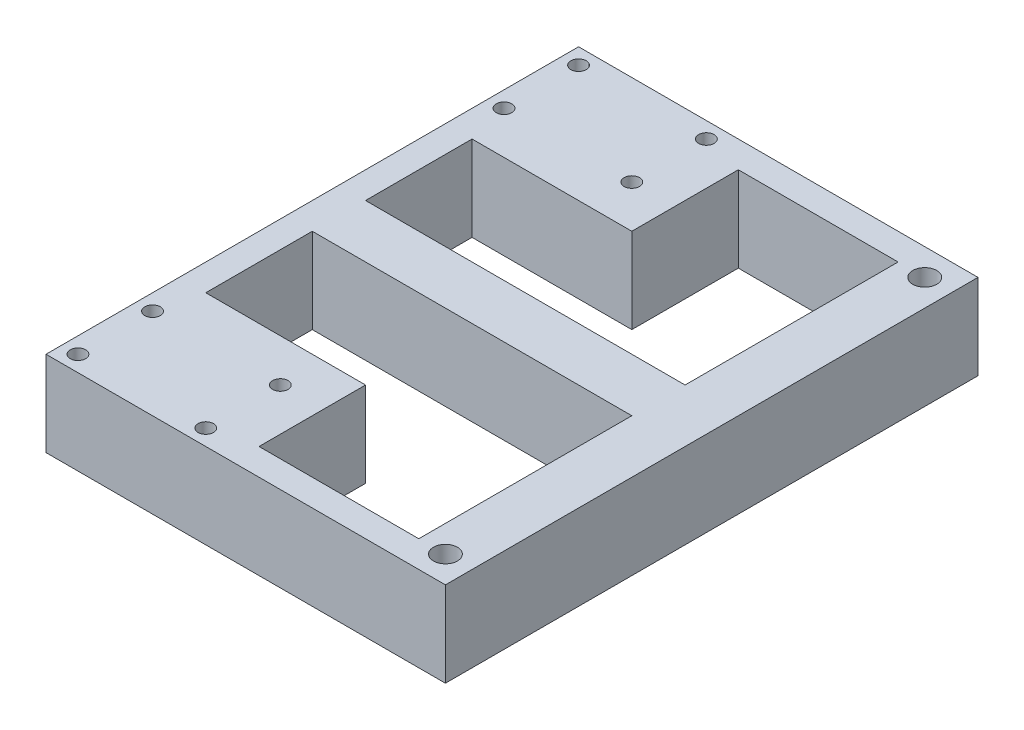
from build123d import *

# Parameters (mm, degrees)
SKETCH_1_W          = 75
SKETCH_1_H          = 100
EXTRUDE_1_DEPTH     = 16
CUT_EXTRUDE_5_REACH = 128.02
SKETCH_8_R          = 1.45
CUT_EXTRUDE_7_DEPTH = 127.019839708
SKETCH_9_W          = 40
SKETCH_9_H          = 16
EXTRUDE_2_DEPTH     = 5
SKETCH_10_R         = 2.25
CUT_EXTRUDE_8_DEPTH = 5
CUT_EXTRUDE_START   = -5
SKETCH_11_R         = 2.25
CUT_EXTRUDE_9_DEPTH = 5


with BuildPart() as part:
    # 草图1 → 凸台-拉伸1 (new body)
    with BuildSketch(Plane(origin=(0, 0, 0), x_dir=(1, 0, 0), z_dir=(0, 1, 0))):
        with Locations((-37.5, 50)):
            Rectangle(SKETCH_1_W, SKETCH_1_H)
    extrude(amount=EXTRUDE_1_DEPTH)

    # 草图6 → 切除-拉伸5 (cut, up to next)
    with BuildSketch(Plane(origin=(0, 16, 0), x_dir=(1, 0, 0), z_dir=(0, 1, 0)), mode=Mode.PRIVATE) as cut_extrude_5_sk1:
        Polygon((-40, 45), (-5, 45), (-5, 5), (-40, 5), (-40, 25), (-70, 25), (-70, 45), align=None)
    cut_extrude_5_tool1 = extrude(cut_extrude_5_sk1.sketch, amount=-CUT_EXTRUDE_5_REACH, mode=Mode.PRIVATE) & part.part
    # 草图6 → 切除-拉伸5 (cut, up to next)
    with BuildSketch(Plane(origin=(0, 16, 0), x_dir=(1, 0, 0), z_dir=(0, 1, 0)), mode=Mode.PRIVATE) as cut_extrude_5_sk2:
        Polygon((-40, 95), (-5, 95), (-5, 55), (-40, 55), (-70, 55), (-70, 75), (-40, 75), align=None)
    cut_extrude_5_tool2 = extrude(cut_extrude_5_sk2.sketch, amount=-CUT_EXTRUDE_5_REACH, mode=Mode.PRIVATE) & part.part
    add(cut_extrude_5_tool1.solids().sort_by_distance((-32.25, 16, -28))[0], mode=Mode.SUBTRACT)
    add(cut_extrude_5_tool2.solids().sort_by_distance((-32.25, 16, -72))[0], mode=Mode.SUBTRACT)

    # 草图8 → 切除-拉伸7 (cut, through all)
    with BuildSketch(Plane(origin=(0, 16, 0), x_dir=(1, 0, 0), z_dir=(0, 1, 0))):
        with Locations(Location((-72, 97, 0), (0, 0, 270))):
            Circle(SKETCH_8_R)
        with Locations(Location((-72, 83, 0), (0, 0, 270))):
            Circle(SKETCH_8_R)
        with Locations(Location((-48, 97, 0), (0, 0, 270))):
            Circle(SKETCH_8_R)
        with Locations(Location((-48, 83, 0), (0, 0, 270))):
            Circle(SKETCH_8_R)
        with Locations(Location((-48, 17, 0), (0, 0, 90))):
            Circle(SKETCH_8_R)
        with Locations(Location((-48, 3, 0), (0, 0, 90))):
            Circle(SKETCH_8_R)
        with Locations(Location((-72, 17, 0), (0, 0, 90))):
            Circle(SKETCH_8_R)
        with Locations(Location((-72, 3, 0), (0, 0, 90))):
            Circle(SKETCH_8_R)
    extrude(amount=-CUT_EXTRUDE_7_DEPTH, mode=Mode.SUBTRACT)

    # 草图9 → 凸台-拉伸2 (add)
    with BuildSketch(Plane.ZY.offset(5)):
        with Locations((-25, 8)):
            Rectangle(SKETCH_9_W, SKETCH_9_H)
        with Locations((-75, 8)):
            Rectangle(SKETCH_9_W, SKETCH_9_H)
    extrude(amount=EXTRUDE_2_DEPTH)

    # 草图10 → 切除-拉伸8 (cut)
    with BuildSketch(Plane(origin=(0, 16, 0), x_dir=(1, 0, 0), z_dir=(0, 1, 0))):
        with Locations(Location((-5, 95, 0), (0, 0, 270))):
            Circle(SKETCH_10_R)
        with Locations(Location((-5, 5, 0), (0, 0, 90))):
            Circle(SKETCH_10_R)
    extrude(amount=-CUT_EXTRUDE_8_DEPTH, mode=Mode.SUBTRACT)

    # 草图11 → 切除-拉伸9 (cut)
    with BuildSketch(Plane.XZ.offset(CUT_EXTRUDE_START)):
        with Locations(Location((-5, -95, 0), (0, 0, 90))):
            Circle(SKETCH_11_R)
        with Locations(Location((-5, -5, 0), (0, 0, 270))):
            Circle(SKETCH_11_R)
    extrude(amount=CUT_EXTRUDE_9_DEPTH, mode=Mode.SUBTRACT)


solid = part.part
